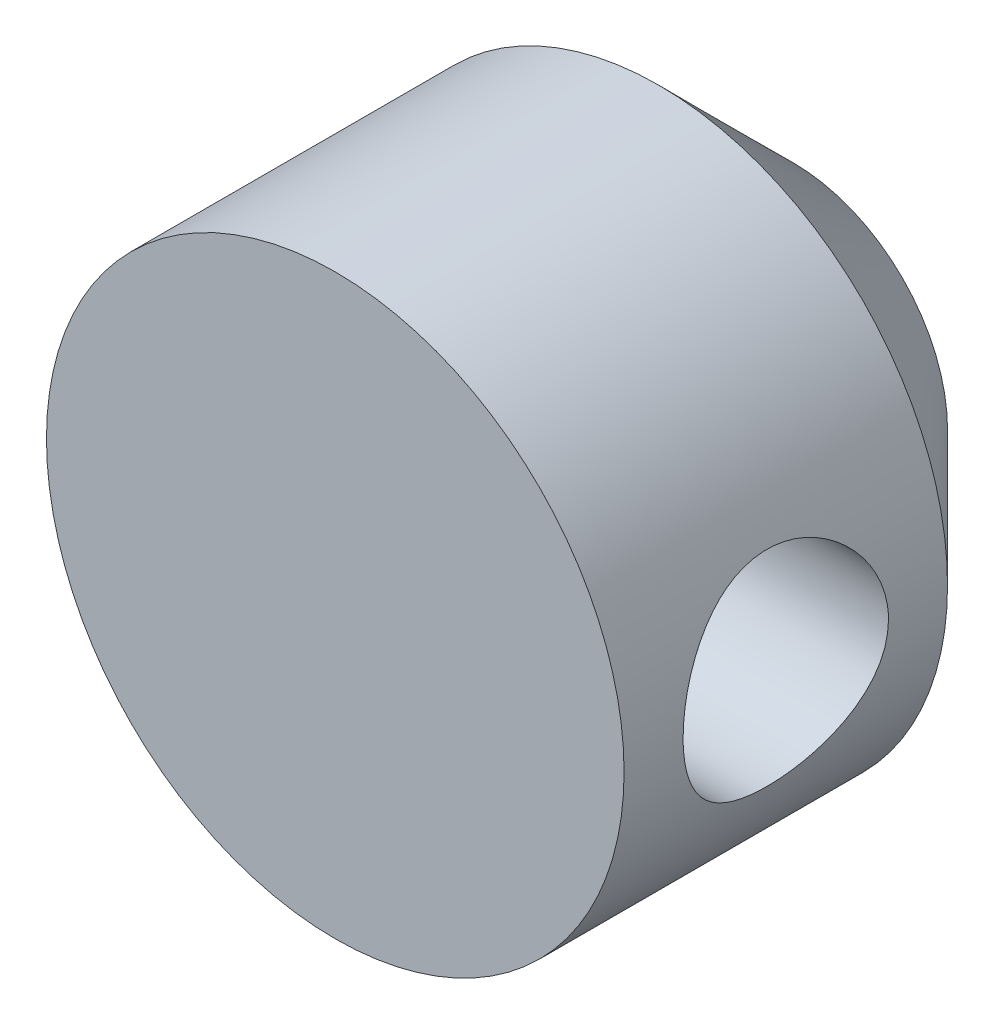
from build123d import *

# Parameters (mm, degrees)
SKETCH1_R               = 28.575
BOSS_EXTRUDE1_DEPTH     = 25
BOSS_EXTRUDE1_DRAFT     = -45
SKETCH3_R               = 53.575
BOSS_EXTRUDE2_DEPTH     = 60
CUT_EXTRUDE1_DEPTH      = 114.866418447
CUT_EXTRUDE1_DEPTH_BACK = 114.866418447
SKETCH4_R               = 19.05


with BuildPart() as part:
    # Sketch1 → Boss-Extrude1 (with draft: the straight prism first)
    with BuildSketch(Plane.XY):
        Circle(SKETCH1_R)
    extrude(amount=BOSS_EXTRUDE1_DEPTH)
    # Boss-Extrude1: the draft: its side faces are tilted about the plane it starts from
    boss_extrude1_sides = [part.faces().sort_by_distance(p)[0] for p in [
        (-28.575, 0, 12.5),
    ]]
    draft(boss_extrude1_sides, Plane.XY, BOSS_EXTRUDE1_DRAFT)

    # Sketch3 → Boss-Extrude2 (add)
    with BuildSketch(Plane.XY.offset(25)):
        Circle(SKETCH3_R)
    extrude(amount=BOSS_EXTRUDE2_DEPTH)

    # Sketch4 → Cut-Extrude1 (cut, two sides: drawn at the far end of the back side and taken through both)
    with BuildSketch(Plane(origin=(0, 0, 0), x_dir=(0, 0, -1), z_dir=(1, 0, 0)).offset(-CUT_EXTRUDE1_DEPTH_BACK)):
        with Locations((-55, 0)):
            Circle(SKETCH4_R)
    extrude(amount=CUT_EXTRUDE1_DEPTH + CUT_EXTRUDE1_DEPTH_BACK, mode=Mode.SUBTRACT)


solid = part.part
